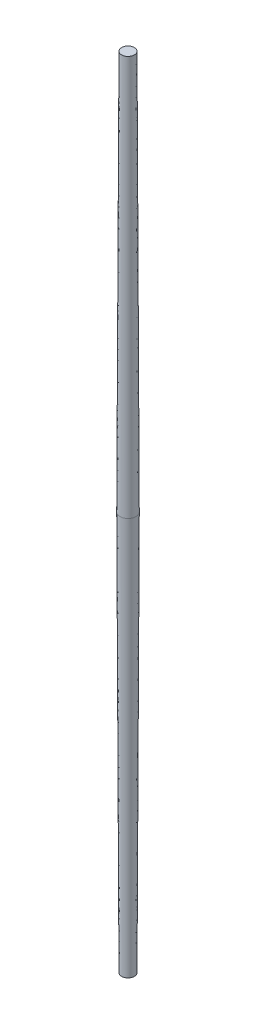
from build123d import *

# Parameters (mm, degrees)
ECHELLE1_SCALE = 1.5


with BuildPart() as part:
    # Esquisse1 → Révolution1 (revolve)
    with BuildSketch(Plane.XY, mode=Mode.PRIVATE) as r_volution1_sk:
        Polygon((0, 0), (5, 0), (4, 250), (0, 250), align=None)
    r_volution1 = revolve(r_volution1_sk.sketch.rotate(Axis((0, 250, 0), (0, -1, 0)), 180), axis=Axis((0, 250, 0), (0, -1, 0)))

    # Symétrie1: Révolution1 across plane
    add(r_volution1.mirror(Plane.ZX))


with BuildPart() as part_1:
    # Echelle1: scaled about (0, 0, 0)
    add(part.part.scale(ECHELLE1_SCALE))


solid = part_1.part
